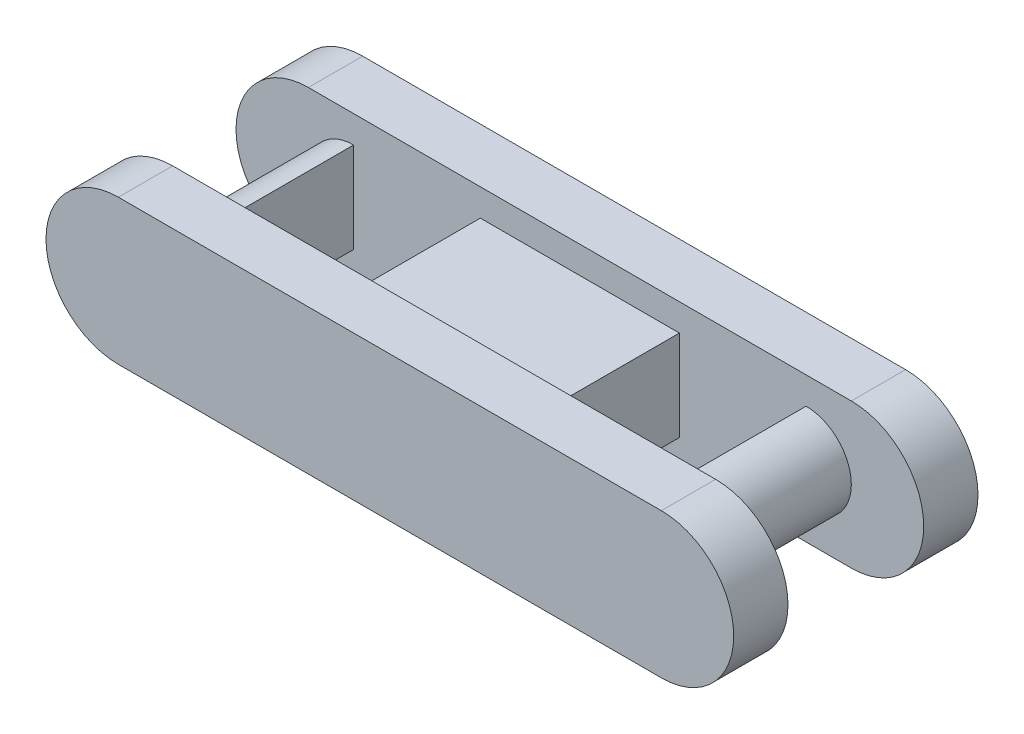
from build123d import *

# Parameters (mm, degrees)
BOSS_EXTRUDE1_DEPTH = 3
BOSS_EXTRUDE2_DEPTH = 7.5
SKETCH6_W           = 7
SKETCH6_H           = 7.5
CUT_EXTRUDE1_DEPTH  = 7.5


with BuildPart() as part:
    # Sketch1 → Boss-Extrude1 (new body)
    with BuildSketch(Plane.XY):
        with BuildLine():
            Line((-15, 4), (15, 4))
            ThreePointArc((15, 4), (19, 0), (15, -4))
            Line((15, -4), (-15, -4))
            ThreePointArc((-15, -4), (-19, 0), (-15, 4))
        make_face()
    boss_extrude1 = extrude(amount=BOSS_EXTRUDE1_DEPTH)

    # Sketch4 → Boss-Extrude2 (add)
    with BuildSketch(Plane.XY.offset(3)):
        with BuildLine():
            Line((-12.5, 2.5), (12.5, 2.5))
            ThreePointArc((12.5, 2.5), (15, 0), (12.5, -2.5))
            Line((12.5, -2.5), (-12.5, -2.5))
            ThreePointArc((-12.5, -2.5), (-15, 0), (-12.5, 2.5))
        make_face()
    extrude(amount=BOSS_EXTRUDE2_DEPTH)

    # Mirror1: Boss-Extrude1 across plane
    add(boss_extrude1.mirror(Plane.XY.offset(6.75)))

    # Sketch6 → Cut-Extrude1 (cut)
    with BuildSketch(Plane(origin=(0, 2.5, 0), x_dir=(1, 0, 0), z_dir=(0, 1, 0))):
        with Locations((-9, -6.75)):
            Rectangle(SKETCH6_W, SKETCH6_H)
        with Locations((9, -6.75)):
            Rectangle(SKETCH6_W, SKETCH6_H)
    extrude(amount=-CUT_EXTRUDE1_DEPTH, mode=Mode.SUBTRACT)


solid = part.part
